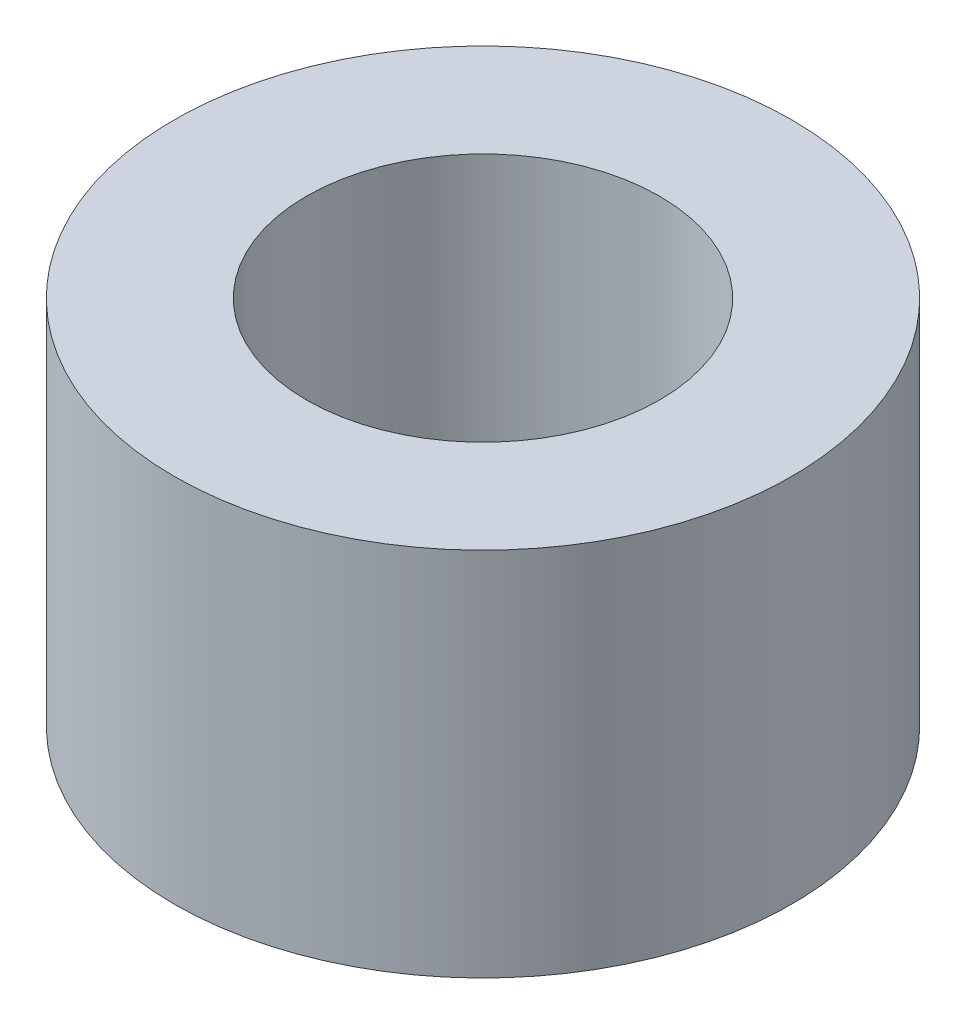
from build123d import *

# Parameters (mm, degrees)
SKETCH1_R           = 5.334
SKETCH1_R_2         = 3.05
BOSS_EXTRUDE1_DEPTH = 6.4


with BuildPart() as part:
    # Sketch1 → Boss-Extrude1 (new body)
    with BuildSketch(Plane(origin=(0, 0, 0), x_dir=(1, 0, 0), z_dir=(0, 1, 0))):
        with Locations(Location((0, 0, 0), (0, 0, 270))):
            Circle(SKETCH1_R)
        with Locations(Location((0, 0, 0), (0, 0, 270))):
            Circle(SKETCH1_R_2, mode=Mode.SUBTRACT)
    extrude(amount=BOSS_EXTRUDE1_DEPTH)


solid = part.part
